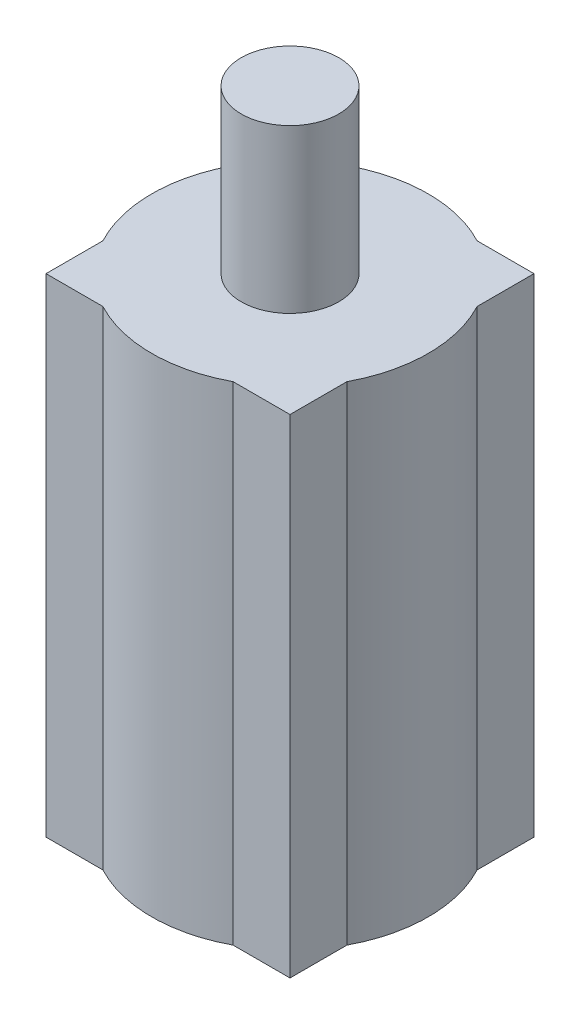
from build123d import *

# Parameters (mm, degrees)
SKETCH1_R           = 8.5
SKETCH1_W           = 15
SKETCH1_H           = 15
BOSS_EXTRUDE1_DEPTH = 30
SKETCH2_R           = 3
BOSS_EXTRUDE2_DEPTH = 10


with BuildPart() as part:
    # Sketch1 → Boss-Extrude1 (new body)
    with BuildSketch(Plane(origin=(0, 0, 0), x_dir=(1, 0, 0), z_dir=(0, 1, 0))):
        Circle(SKETCH1_R)
        Rectangle(SKETCH1_W, SKETCH1_H)
    extrude(amount=BOSS_EXTRUDE1_DEPTH)

    # Sketch2 → Boss-Extrude2 (add)
    with BuildSketch(Plane(origin=(0, 30, 0), x_dir=(1, 0, 0), z_dir=(0, 1, 0))):
        with Locations(Location((0, 0, 0), (0, 0, 90))):
            Circle(SKETCH2_R)
    extrude(amount=BOSS_EXTRUDE2_DEPTH)


solid = part.part
